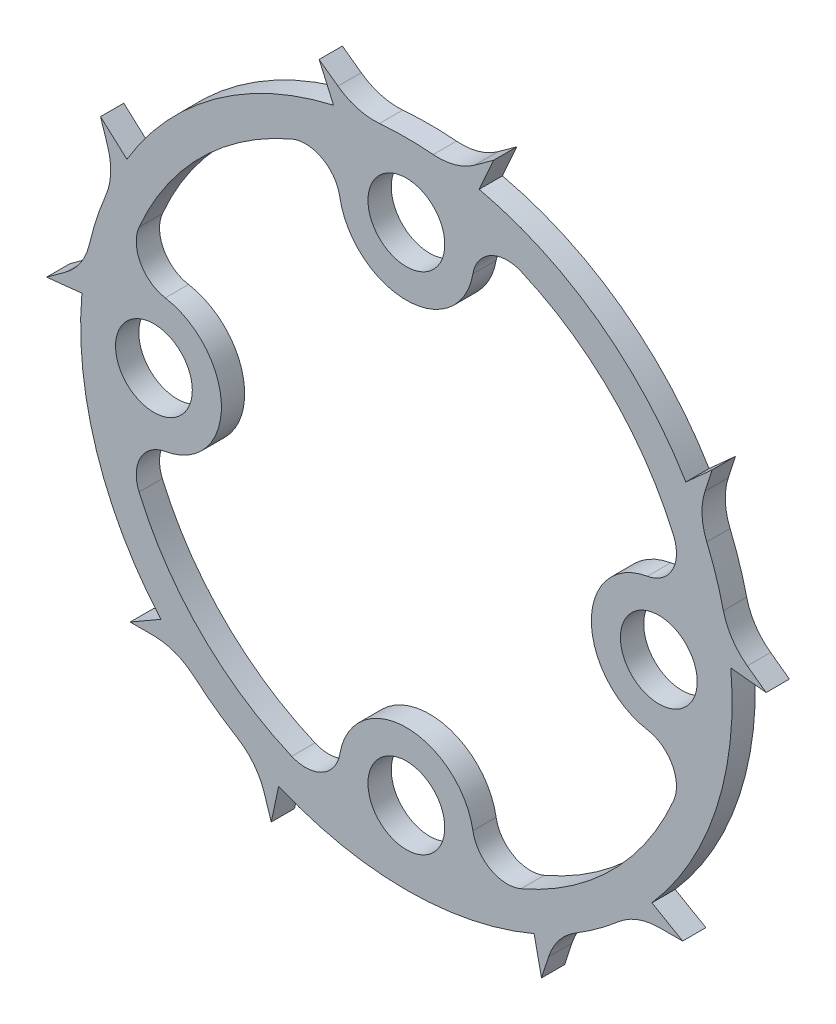
from build123d import *

# Parameters (mm, degrees)
SKETCH5_R                  = 14
SKETCH5_R_2                = 12.5
RING_DEPTH                 = 1
TEETH_DEPTH                = 1
SCREW_BUMPS_DEPTH          = 1
SCREW_CLEARENCE_HOLE_REACH = 22.572
SKETCH8_R                  = 1.65
CIR_PAT_FOR_SCREWS_COUNT   = 4
CIR_PAT_TEETH_COUNT        = 5


with BuildPart() as part:
    # Sketch5 → ring (new body)
    with BuildSketch(Plane.XY):
        Circle(SKETCH5_R)
        Circle(SKETCH5_R_2, mode=Mode.SUBTRACT)
    extrude(amount=RING_DEPTH)

    # Sketch6 → teeth (add)
    with BuildSketch(Plane.XY):
        with BuildLine():
            Line((-3.75, 15.039531243), (-2.940974774, 14.45175732))
            ThreePointArc((-2.940974774, 14.45175732), (-2.093195964, 14.041639747), (-1.155683759, 13.952218284))
            ThreePointArc((-1.155683759, 13.952218284), (-2.148028374, 13.834231967), (-3.129428252, 13.645756806))
            Line((-3.129428252, 13.645756806), (-3.75, 15.039531243))
        make_face()
        with BuildLine():
            Line((3.75, 15.039531243), (3.129428252, 13.645756806))
            ThreePointArc((3.129428252, 13.645756806), (2.148028374, 13.834231967), (1.155683759, 13.952218284))
            ThreePointArc((1.155683759, 13.952218284), (2.093195964, 14.041639747), (2.940974774, 14.45175732))
            Line((2.940974774, 14.45175732), (3.75, 15.039531243))
        make_face()
    teeth = extrude(amount=TEETH_DEPTH)

    # Sketch7 → screw bumps (add)
    with BuildSketch(Plane.XY):
        with BuildLine():
            Line((4.928560895, 11.487353372), (4.928560895, 13.103789051))
            Line((4.928560895, 13.103789051), (-4.928560895, 13.103789051))
            Line((-4.928560895, 13.103789051), (-4.928560895, 11.487353372))
            ThreePointArc((-4.928560895, 11.487353372), (-3.62045714, 11.426586745), (-2.858565319, 10.361528592))
            ThreePointArc((-2.858565319, 10.361528592), (0, 7.95), (2.858565319, 10.361528592))
            ThreePointArc((2.858565319, 10.361528592), (3.62045714, 11.426586745), (4.928560895, 11.487353372))
        make_face()
    screw_bumps = extrude(amount=SCREW_BUMPS_DEPTH)

    # Sketch8 → screw clearence hole (cut, up to next)
    with BuildSketch(Plane.XY.offset(1), mode=Mode.PRIVATE) as screw_clearence_hole_sk1:
        with Locations((0, 10.85)):
            Circle(SKETCH8_R)
    screw_clearence_hole_tool1 = extrude(screw_clearence_hole_sk1.sketch, amount=-SCREW_CLEARENCE_HOLE_REACH, mode=Mode.PRIVATE) & part.part
    screw_clearence_hole = screw_clearence_hole_tool1.solids().sort_by_distance((0, 10.85, 1))[0]
    add(screw_clearence_hole, mode=Mode.SUBTRACT)

    # cir pat for screws: screw bumps, screw clearence hole ×4 about axis
    cir_pat_for_screws_axis = Axis((0, 0, 0), (0, 0, 1))
    add([screw_bumps.rotate(cir_pat_for_screws_axis, i * 360 / CIR_PAT_FOR_SCREWS_COUNT) for i in range(1, CIR_PAT_FOR_SCREWS_COUNT)])
    add([screw_clearence_hole.rotate(cir_pat_for_screws_axis, i * 360 / CIR_PAT_FOR_SCREWS_COUNT) for i in range(1, CIR_PAT_FOR_SCREWS_COUNT)], mode=Mode.SUBTRACT)

    # cir.pat. teeth: teeth ×5 about axis
    cir_pat_teeth_axis = Axis((0, 0, 0), (0, 0, 1))
    for i in range(1, CIR_PAT_TEETH_COUNT):
        add(teeth.rotate(cir_pat_teeth_axis, i * 360 / CIR_PAT_TEETH_COUNT))


solid = part.part
